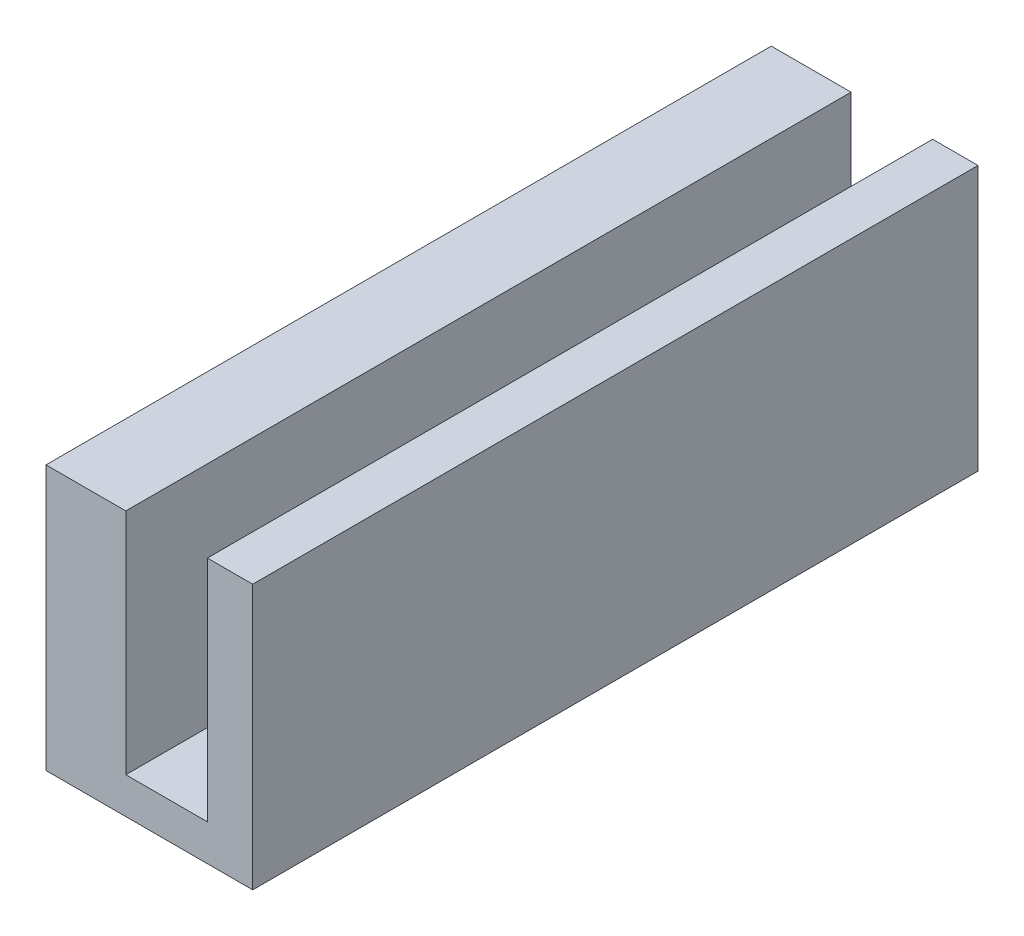
from build123d import *

# Parameters (mm, degrees)
SKETCH1_W           = 5.7
SKETCH1_H           = 20
BOSS_EXTRUDE1_DEPTH = 1
SKETCH2_W           = 2.2
SKETCH2_H           = 20
SKETCH2_W_2         = 1.25
BOSS_EXTRUDE2_DEPTH = 6.3


with BuildPart() as part:
    # Sketch1 → Boss-Extrude1 (new body)
    with BuildSketch(Plane(origin=(0, 0, 0), x_dir=(1, 0, 0), z_dir=(0, 1, 0))):
        with Locations((2.85, 10)):
            Rectangle(SKETCH1_W, SKETCH1_H)
    extrude(amount=BOSS_EXTRUDE1_DEPTH)

    # Sketch2 → Boss-Extrude2 (add)
    with BuildSketch(Plane(origin=(0, 1, 0), x_dir=(1, 0, 0), z_dir=(0, 1, 0))):
        with Locations((1.1, 10)):
            Rectangle(SKETCH2_W, SKETCH2_H)
        with Locations((5.075, 10)):
            Rectangle(SKETCH2_W_2, SKETCH2_H)
    extrude(amount=BOSS_EXTRUDE2_DEPTH)


solid = part.part
